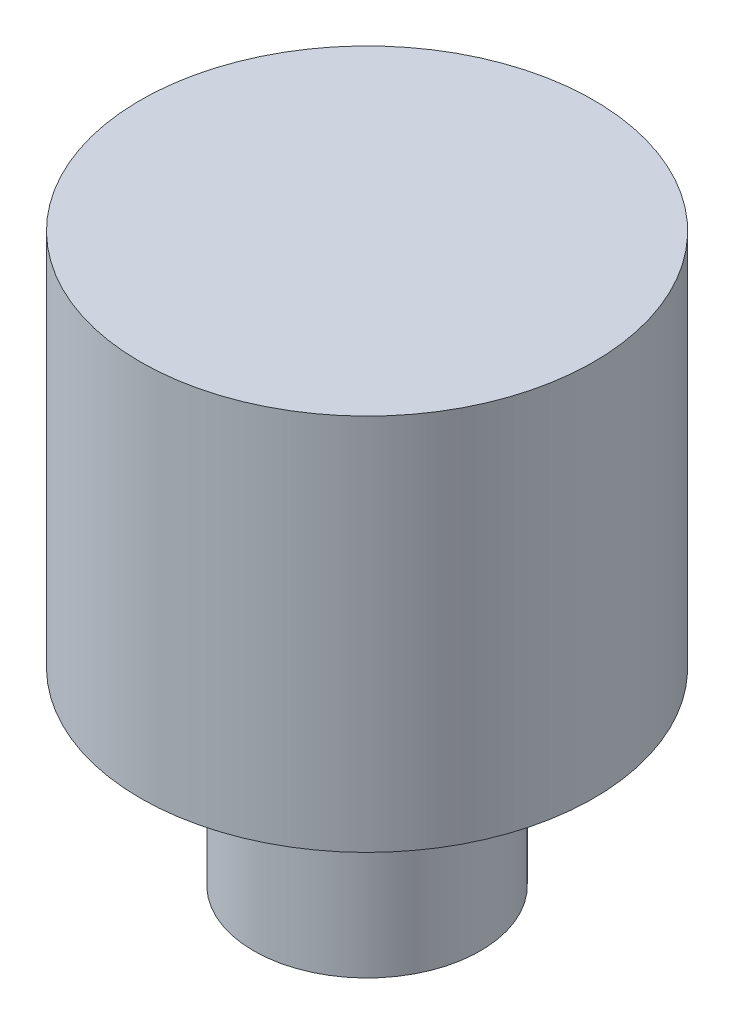
from build123d import *

# Parameters (mm, degrees)
SKETCH1_R           = 76.2
BOSS_EXTRUDE1_DEPTH = 127
SKETCH2_R           = 38.1
BOSS_EXTRUDE2_DEPTH = 63.5


with BuildPart() as part:
    # Sketch1 → Boss-Extrude1 (new body)
    with BuildSketch(Plane(origin=(0, 0, 0), x_dir=(1, 0, 0), z_dir=(0, 1, 0))):
        with Locations(Location((0, 0, 0), (0, 0, 270))):
            Circle(SKETCH1_R)
    extrude(amount=BOSS_EXTRUDE1_DEPTH)

    # Sketch2 → Boss-Extrude2 (add)
    with BuildSketch(Plane.XZ):
        with Locations(Location((0, 0, 0), (0, 0, 270))):
            Circle(SKETCH2_R)
    extrude(amount=BOSS_EXTRUDE2_DEPTH)


solid = part.part
